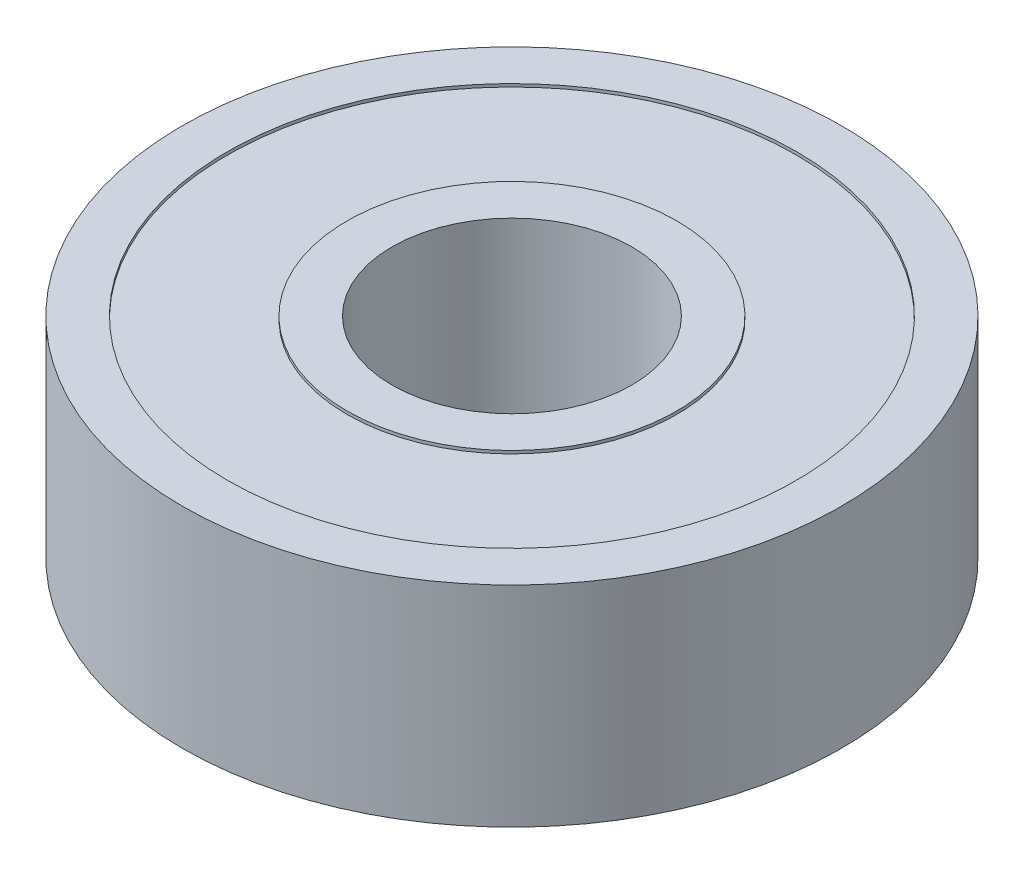
from build123d import *

# Parameters (mm, degrees)
SKETCH1_R           = 11
SKETCH1_R_2         = 4
BOSS_EXTRUDE1_DEPTH = 7
SKETCH2_R           = 9.5
SKETCH2_R_2         = 5.5
CUT_EXTRUDE1_DEPTH  = 0.1
CUT_EXTRUDE2_START  = -0.1
SKETCH3_R           = 9.5
SKETCH3_R_2         = 5.5
CUT_EXTRUDE2_DEPTH  = 0.1


with BuildPart() as part:
    # Sketch1 → Boss-Extrude1 (new body)
    with BuildSketch(Plane(origin=(0, 0, 0), x_dir=(1, 0, 0), z_dir=(0, 1, 0))):
        with Locations(Location((0, 0, 0), (0, 0, 270))):
            Circle(SKETCH1_R)
        with Locations(Location((0, 0, 0), (0, 0, 270))):
            Circle(SKETCH1_R_2, mode=Mode.SUBTRACT)
    extrude(amount=BOSS_EXTRUDE1_DEPTH)

    # Sketch2 → Cut-Extrude1 (cut)
    with BuildSketch(Plane(origin=(0, 7, 0), x_dir=(1, 0, 0), z_dir=(0, 1, 0))):
        with Locations(Location((0, 0, 0), (0, 0, 270))):
            Circle(SKETCH2_R)
        with Locations(Location((0, 0, 0), (0, 0, 270))):
            Circle(SKETCH2_R_2, mode=Mode.SUBTRACT)
    extrude(amount=-CUT_EXTRUDE1_DEPTH, mode=Mode.SUBTRACT)

    # Sketch3 → Cut-Extrude2 (cut)
    with BuildSketch(Plane.XZ.offset(CUT_EXTRUDE2_START)):
        with Locations(Location((0, 0, 0), (0, 0, 90))):
            Circle(SKETCH3_R)
        with Locations(Location((0, 0, 0), (0, 0, 90))):
            Circle(SKETCH3_R_2, mode=Mode.SUBTRACT)
    extrude(amount=CUT_EXTRUDE2_DEPTH, mode=Mode.SUBTRACT)


solid = part.part
